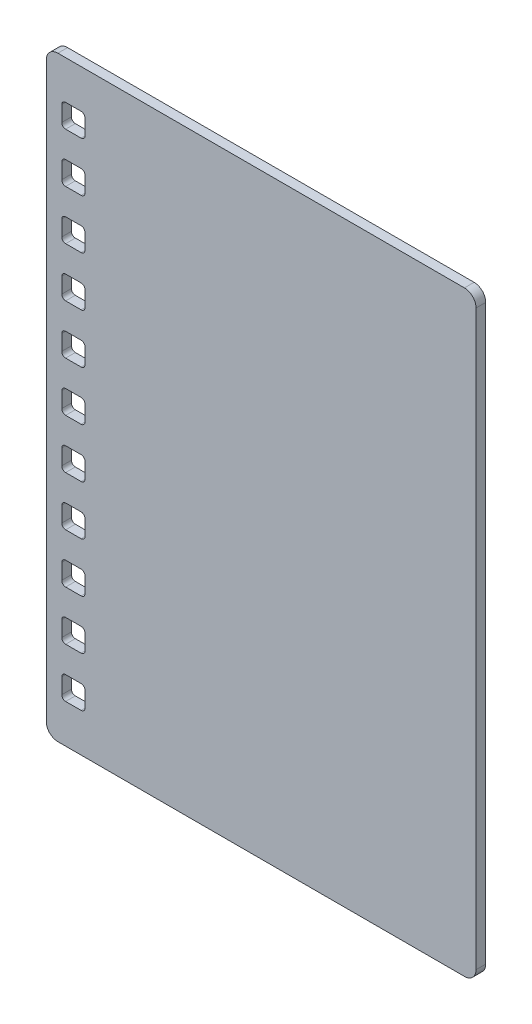
from build123d import *

# Parameters (mm, degrees)
BOSS_EXTRUDE1_DEPTH = 2.5


with BuildPart() as part:
    # Sketch1 → Boss-Extrude1 (new body)
    with BuildSketch(Plane.XY):
        with BuildLine():
            Line((3, 0), (108, 0))
            ThreePointArc((108, 0), (110.121320344, 0.878679656), (111, 3))
            Line((111, 3), (111, 151))
            ThreePointArc((111, 151), (110.121320344, 153.121320344), (108, 154))
            Line((108, 154), (3, 154))
            ThreePointArc((3, 154), (0.878679656, 153.121320344), (0, 151))
            Line((0, 151), (0, 3))
            ThreePointArc((0, 3), (0.878679656, 0.878679656), (3, 0))
        make_face()
        with BuildLine():
            Line((5, 22.8), (9, 22.8))
            ThreePointArc((9, 22.8), (9.707106781, 23.092893219), (10, 23.8))
            Line((10, 23.8), (10, 27.8))
            ThreePointArc((10, 27.8), (9.707106781, 28.507106781), (9, 28.8))
            Line((9, 28.8), (5, 28.8))
            ThreePointArc((5, 28.8), (4.292893219, 28.507106781), (4, 27.8))
            Line((4, 27.8), (4, 23.8))
            ThreePointArc((4, 23.8), (4.292893219, 23.092893219), (5, 22.8))
        make_face(mode=Mode.SUBTRACT)
        with BuildLine():
            Line((5, 16), (9, 16))
            ThreePointArc((9, 16), (9.707106781, 15.707106781), (10, 15))
            Line((10, 15), (10, 11))
            ThreePointArc((10, 11), (9.707106781, 10.292893219), (9, 10))
            Line((9, 10), (5, 10))
            ThreePointArc((5, 10), (4.292893219, 10.292893219), (4, 11))
            Line((4, 11), (4, 15))
            ThreePointArc((4, 15), (4.292893219, 15.707106781), (5, 16))
        make_face(mode=Mode.SUBTRACT)
        with BuildLine():
            Line((5, 35.6), (9, 35.6))
            ThreePointArc((9, 35.6), (9.707106781, 35.892893219), (10, 36.6))
            Line((10, 36.6), (10, 40.6))
            ThreePointArc((10, 40.6), (9.707106781, 41.307106781), (9, 41.6))
            Line((9, 41.6), (5, 41.6))
            ThreePointArc((5, 41.6), (4.292893219, 41.307106781), (4, 40.6))
            Line((4, 40.6), (4, 36.6))
            ThreePointArc((4, 36.6), (4.292893219, 35.892893219), (5, 35.6))
        make_face(mode=Mode.SUBTRACT)
        with BuildLine():
            Line((5, 48.4), (9, 48.4))
            ThreePointArc((9, 48.4), (9.707106781, 48.692893219), (10, 49.4))
            Line((10, 49.4), (10, 53.4))
            ThreePointArc((10, 53.4), (9.707106781, 54.107106781), (9, 54.4))
            Line((9, 54.4), (5, 54.4))
            ThreePointArc((5, 54.4), (4.292893219, 54.107106781), (4, 53.4))
            Line((4, 53.4), (4, 49.4))
            ThreePointArc((4, 49.4), (4.292893219, 48.692893219), (5, 48.4))
        make_face(mode=Mode.SUBTRACT)
        with BuildLine():
            Line((5, 61.2), (9, 61.2))
            ThreePointArc((9, 61.2), (9.707106781, 61.492893219), (10, 62.2))
            Line((10, 62.2), (10, 66.2))
            ThreePointArc((10, 66.2), (9.707106781, 66.907106781), (9, 67.2))
            Line((9, 67.2), (5, 67.2))
            ThreePointArc((5, 67.2), (4.292893219, 66.907106781), (4, 66.2))
            Line((4, 66.2), (4, 62.2))
            ThreePointArc((4, 62.2), (4.292893219, 61.492893219), (5, 61.2))
        make_face(mode=Mode.SUBTRACT)
        with BuildLine():
            Line((5, 74), (9, 74))
            ThreePointArc((9, 74), (9.707106781, 74.292893219), (10, 75))
            Line((10, 75), (10, 79))
            ThreePointArc((10, 79), (9.707106781, 79.707106781), (9, 80))
            Line((9, 80), (5, 80))
            ThreePointArc((5, 80), (4.292893219, 79.707106781), (4, 79))
            Line((4, 79), (4, 75))
            ThreePointArc((4, 75), (4.292893219, 74.292893219), (5, 74))
        make_face(mode=Mode.SUBTRACT)
        with BuildLine():
            Line((5, 86.8), (9, 86.8))
            ThreePointArc((9, 86.8), (9.707106781, 87.092893219), (10, 87.8))
            Line((10, 87.8), (10, 91.8))
            ThreePointArc((10, 91.8), (9.707106781, 92.507106781), (9, 92.8))
            Line((9, 92.8), (5, 92.8))
            ThreePointArc((5, 92.8), (4.292893219, 92.507106781), (4, 91.8))
            Line((4, 91.8), (4, 87.8))
            ThreePointArc((4, 87.8), (4.292893219, 87.092893219), (5, 86.8))
        make_face(mode=Mode.SUBTRACT)
        with BuildLine():
            Line((5, 99.6), (9, 99.6))
            ThreePointArc((9, 99.6), (9.707106781, 99.892893219), (10, 100.6))
            Line((10, 100.6), (10, 104.6))
            ThreePointArc((10, 104.6), (9.707106781, 105.307106781), (9, 105.6))
            Line((9, 105.6), (5, 105.6))
            ThreePointArc((5, 105.6), (4.292893219, 105.307106781), (4, 104.6))
            Line((4, 104.6), (4, 100.6))
            ThreePointArc((4, 100.6), (4.292893219, 99.892893219), (5, 99.6))
        make_face(mode=Mode.SUBTRACT)
        with BuildLine():
            Line((5, 112.4), (9, 112.4))
            ThreePointArc((9, 112.4), (9.707106781, 112.692893219), (10, 113.4))
            Line((10, 113.4), (10, 117.4))
            ThreePointArc((10, 117.4), (9.707106781, 118.107106781), (9, 118.4))
            Line((9, 118.4), (5, 118.4))
            ThreePointArc((5, 118.4), (4.292893219, 118.107106781), (4, 117.4))
            Line((4, 117.4), (4, 113.4))
            ThreePointArc((4, 113.4), (4.292893219, 112.692893219), (5, 112.4))
        make_face(mode=Mode.SUBTRACT)
        with BuildLine():
            Line((5, 125.2), (9, 125.2))
            ThreePointArc((9, 125.2), (9.707106781, 125.492893219), (10, 126.2))
            Line((10, 126.2), (10, 130.2))
            ThreePointArc((10, 130.2), (9.707106781, 130.907106781), (9, 131.2))
            Line((9, 131.2), (5, 131.2))
            ThreePointArc((5, 131.2), (4.292893219, 130.907106781), (4, 130.2))
            Line((4, 130.2), (4, 126.2))
            ThreePointArc((4, 126.2), (4.292893219, 125.492893219), (5, 125.2))
        make_face(mode=Mode.SUBTRACT)
        with BuildLine():
            Line((5, 138), (9, 138))
            ThreePointArc((9, 138), (9.707106781, 138.292893219), (10, 139))
            Line((10, 139), (10, 143))
            ThreePointArc((10, 143), (9.707106781, 143.707106781), (9, 144))
            Line((9, 144), (5, 144))
            ThreePointArc((5, 144), (4.292893219, 143.707106781), (4, 143))
            Line((4, 143), (4, 139))
            ThreePointArc((4, 139), (4.292893219, 138.292893219), (5, 138))
        make_face(mode=Mode.SUBTRACT)
    extrude(amount=BOSS_EXTRUDE1_DEPTH)


solid = part.part
